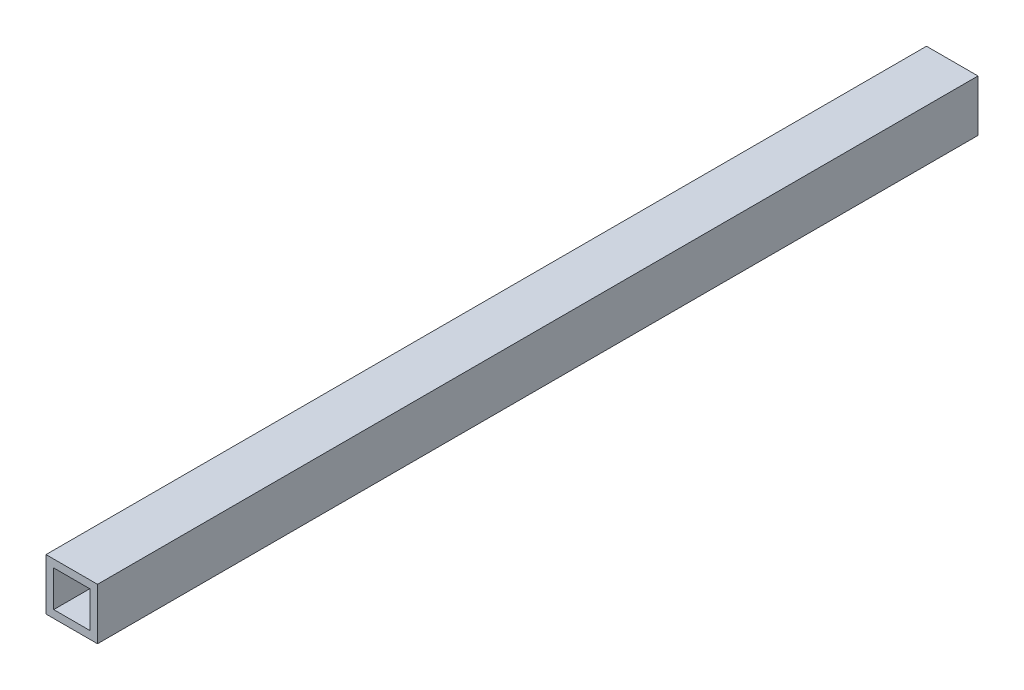
from build123d import *

# Parameters (mm, degrees)
ESQUISSE1_W        = 11.7
ESQUISSE1_H        = 11.7
ESQUISSE1_W_2      = 8.2
ESQUISSE1_H_2      = 8.2
BOSS_EXTRU_1_DEPTH = 200


with BuildPart() as part:
    # Esquisse1 → Boss.-Extru.1 (new body)
    with BuildSketch(Plane.XY):
        with Locations((5.85, 5.85)):
            Rectangle(ESQUISSE1_W, ESQUISSE1_H)
        with Locations((5.85, 5.85)):
            Rectangle(ESQUISSE1_W_2, ESQUISSE1_H_2, mode=Mode.SUBTRACT)
    extrude(amount=BOSS_EXTRU_1_DEPTH)


solid = part.part
